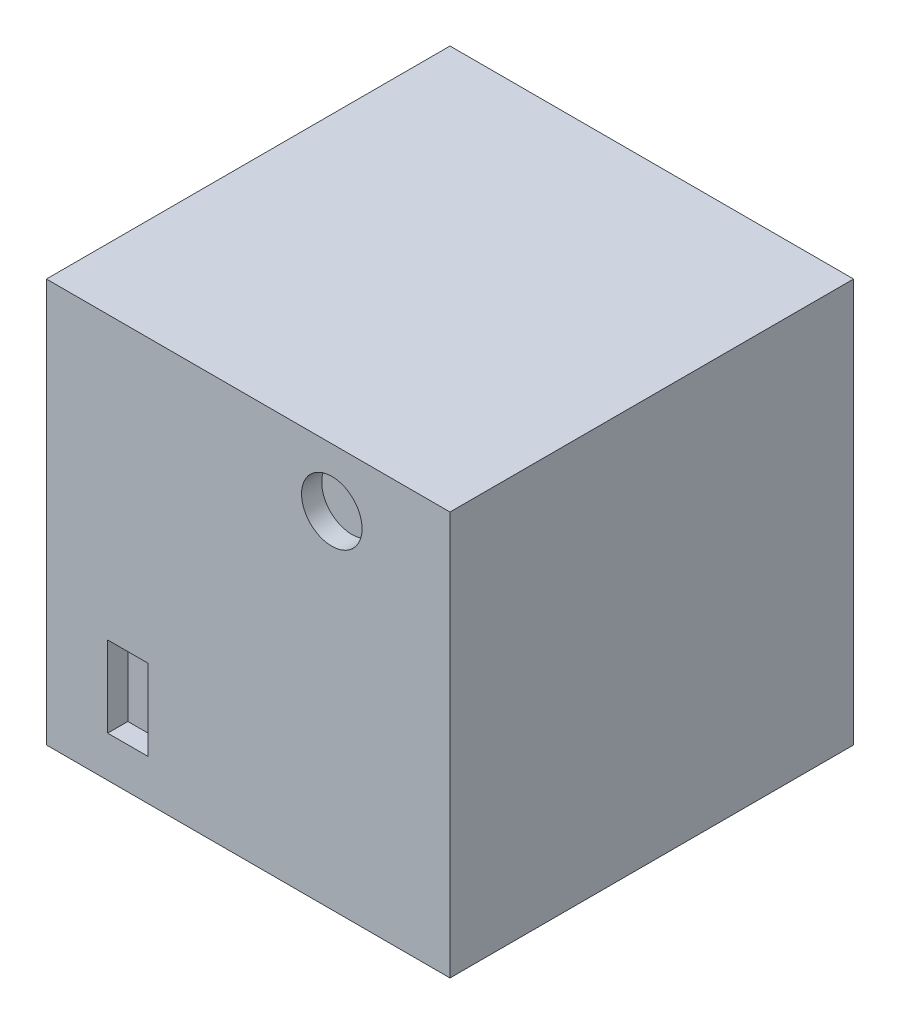
from build123d import *

# Parameters (mm, degrees)
SKETCH1_W           = 10
SKETCH1_H           = 10
BOSS_EXTRUDE1_DEPTH = 10
SKETCH3_R           = 1
CUT_EXTRUDE1_DEPTH  = 1
SKETCH4_W           = 1
SKETCH4_H           = 2
CUT_EXTRUDE2_DEPTH  = 0.5
SKETCH5_R           = 0.75
CUT_EXTRUDE3_DEPTH  = 0.5


with BuildPart() as part:
    # Sketch1 → Boss-Extrude1 (new body)
    with BuildSketch(Plane.XY):
        with Locations((5, 5)):
            Rectangle(SKETCH1_W, SKETCH1_H)
    extrude(amount=-BOSS_EXTRUDE1_DEPTH)

    # Sketch3 → Cut-Extrude1 (cut)
    with BuildSketch(Plane(origin=(0, 0, -3), x_dir=(-1, 0, 0), z_dir=(0, 0, -1))):
        with Locations((-8.022028726, 7.600171924)):
            Circle(SKETCH3_R)
    extrude(amount=-CUT_EXTRUDE1_DEPTH, mode=Mode.SUBTRACT)

    # Sketch4 → Cut-Extrude2 (cut)
    with BuildSketch(Plane.XY):
        with Locations((2.017763854, 2.01343797)):
            Rectangle(SKETCH4_W, SKETCH4_H)
    extrude(amount=-CUT_EXTRUDE2_DEPTH, mode=Mode.SUBTRACT)

    # Sketch5 → Cut-Extrude3 (cut)
    with BuildSketch(Plane.XY):
        with Locations((7.070933391, 8.551267259)):
            Circle(SKETCH5_R)
    extrude(amount=-CUT_EXTRUDE3_DEPTH, mode=Mode.SUBTRACT)


solid = part.part
